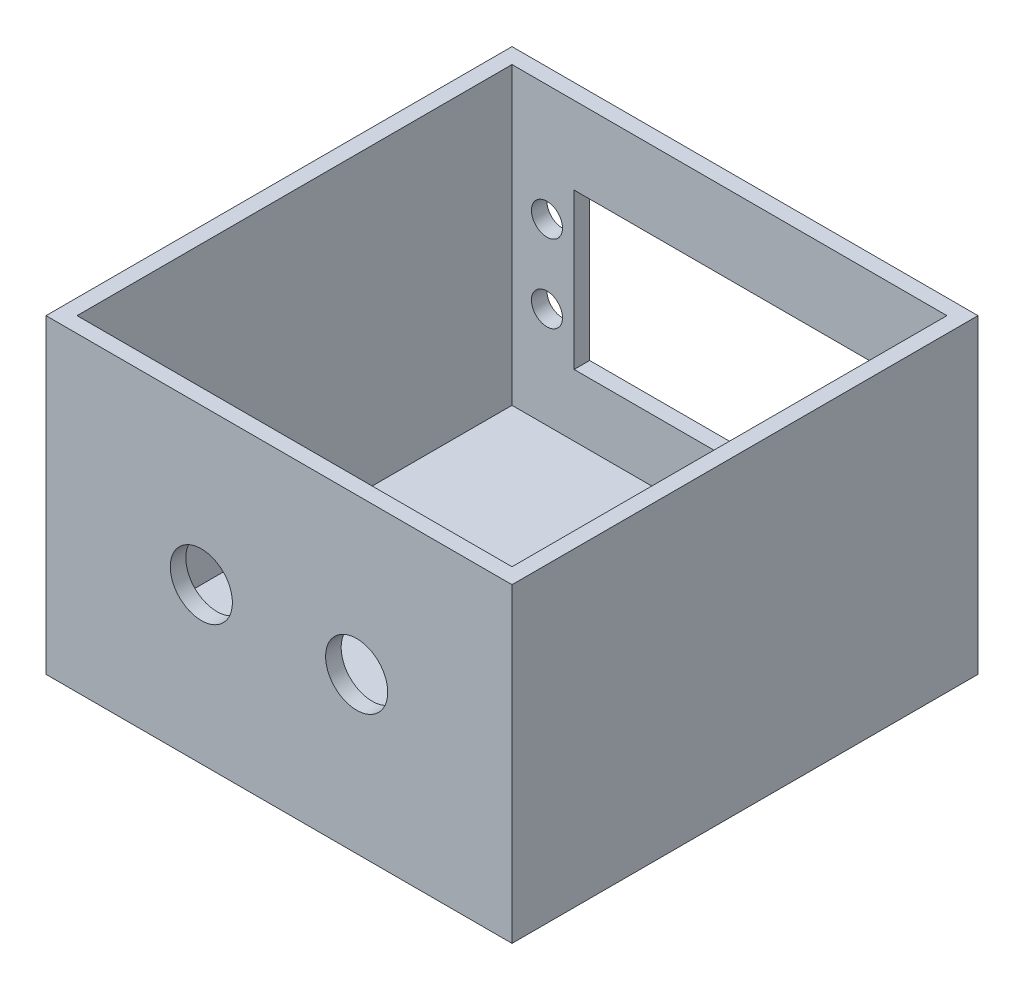
from build123d import *

# Parameters (mm, degrees)
IZIM2_W                     = 60
IZIM2_H                     = 40
Y_KSEKLIK_EKSTR_ZYON1_DEPTH = 60
BO_ALTMA1_T                 = -2
KES_EKSTR_ZYON2_REACH       = 95.808
IZIM4_R                     = 2
IZIM4_W                     = 40
IZIM4_H                     = 20
KES_EKSTR_ZYON3_REACH       = 95.808
IZIM5_R                     = 2
KES_EKSTR_ZYON4_REACH       = 95.808
IZIM6_R                     = 4


with BuildPart() as part:
    # Çizim2 → Yükseklik-Ekstrüzyon1 (new body)
    with BuildSketch(Plane.XY):
        with Locations((30, 20)):
            Rectangle(IZIM2_W, IZIM2_H)
    extrude(amount=Y_KSEKLIK_EKSTR_ZYON1_DEPTH)

    # İç Boşaltma1
    bo_altma1_openings = [part.faces().sort_by_distance(p)[0] for p in [
        (30, 40, 30),
    ]]
    offset(amount=BO_ALTMA1_T, openings=bo_altma1_openings, kind=Kind.INTERSECTION)

    # Çizim4 → Kes-Ekstrüzyon2 (cut, up to next)
    with BuildSketch(Plane(origin=(0, 0, 0), x_dir=(-1, 0, 0), z_dir=(0, 0, -1)), mode=Mode.PRIVATE) as kes_ekstr_zyon2_sk1:
        with Locations((-53.5, 25)):
            Circle(IZIM4_R)
    kes_ekstr_zyon2_tool1 = extrude(kes_ekstr_zyon2_sk1.sketch, amount=-KES_EKSTR_ZYON2_REACH, mode=Mode.PRIVATE) & part.part
    # Çizim4 → Kes-Ekstrüzyon2 (cut, up to next)
    with BuildSketch(Plane(origin=(0, 0, 0), x_dir=(-1, 0, 0), z_dir=(0, 0, -1)), mode=Mode.PRIVATE) as kes_ekstr_zyon2_sk2:
        with Locations((-53.5, 15)):
            Circle(IZIM4_R)
    kes_ekstr_zyon2_tool2 = extrude(kes_ekstr_zyon2_sk2.sketch, amount=-KES_EKSTR_ZYON2_REACH, mode=Mode.PRIVATE) & part.part
    # Çizim4 → Kes-Ekstrüzyon2 (cut, up to next)
    with BuildSketch(Plane(origin=(0, 0, 0), x_dir=(-1, 0, 0), z_dir=(0, 0, -1)), mode=Mode.PRIVATE) as kes_ekstr_zyon2_sk3:
        with Locations((-6.5, 15)):
            Circle(IZIM4_R)
    kes_ekstr_zyon2_tool3 = extrude(kes_ekstr_zyon2_sk3.sketch, amount=-KES_EKSTR_ZYON2_REACH, mode=Mode.PRIVATE) & part.part
    # Çizim4 → Kes-Ekstrüzyon2 (cut, up to next)
    with BuildSketch(Plane(origin=(0, 0, 0), x_dir=(-1, 0, 0), z_dir=(0, 0, -1)), mode=Mode.PRIVATE) as kes_ekstr_zyon2_sk4:
        with Locations((-6.5, 25)):
            Circle(IZIM4_R)
    kes_ekstr_zyon2_tool4 = extrude(kes_ekstr_zyon2_sk4.sketch, amount=-KES_EKSTR_ZYON2_REACH, mode=Mode.PRIVATE) & part.part
    # Çizim4 → Kes-Ekstrüzyon2 (cut, up to next)
    with BuildSketch(Plane(origin=(0, 0, 0), x_dir=(-1, 0, 0), z_dir=(0, 0, -1)), mode=Mode.PRIVATE) as kes_ekstr_zyon2_sk5:
        with Locations((-30, 20)):
            Rectangle(IZIM4_W, IZIM4_H)
    kes_ekstr_zyon2_tool5 = extrude(kes_ekstr_zyon2_sk5.sketch, amount=-KES_EKSTR_ZYON2_REACH, mode=Mode.PRIVATE) & part.part
    add(kes_ekstr_zyon2_tool1.solids().sort_by_distance((53.5, 25, 0))[0], mode=Mode.SUBTRACT)
    add(kes_ekstr_zyon2_tool2.solids().sort_by_distance((53.5, 15, 0))[0], mode=Mode.SUBTRACT)
    add(kes_ekstr_zyon2_tool3.solids().sort_by_distance((6.5, 15, 0))[0], mode=Mode.SUBTRACT)
    add(kes_ekstr_zyon2_tool4.solids().sort_by_distance((6.5, 25, 0))[0], mode=Mode.SUBTRACT)
    add(kes_ekstr_zyon2_tool5.solids().sort_by_distance((30, 20, 0))[0], mode=Mode.SUBTRACT)

    # Çizim5 → Kes-Ekstrüzyon3 (cut, up to next)
    with BuildSketch(Plane.XZ, mode=Mode.PRIVATE) as kes_ekstr_zyon3_sk1:
        with Locations(Location((30, 30, 0), (0, 0, 270))):
            Circle(IZIM5_R)
    kes_ekstr_zyon3_tool1 = extrude(kes_ekstr_zyon3_sk1.sketch, amount=-KES_EKSTR_ZYON3_REACH, mode=Mode.PRIVATE) & part.part
    # Çizim5 → Kes-Ekstrüzyon3 (cut, up to next)
    with BuildSketch(Plane.XZ, mode=Mode.PRIVATE) as kes_ekstr_zyon3_sk2:
        with Locations(Location((38, 30, 0), (0, 0, 270))):
            Circle(IZIM5_R)
    kes_ekstr_zyon3_tool2 = extrude(kes_ekstr_zyon3_sk2.sketch, amount=-KES_EKSTR_ZYON3_REACH, mode=Mode.PRIVATE) & part.part
    # Çizim5 → Kes-Ekstrüzyon3 (cut, up to next)
    with BuildSketch(Plane.XZ, mode=Mode.PRIVATE) as kes_ekstr_zyon3_sk3:
        with Locations(Location((30, 38, 0), (0, 0, 270))):
            Circle(IZIM5_R)
    kes_ekstr_zyon3_tool3 = extrude(kes_ekstr_zyon3_sk3.sketch, amount=-KES_EKSTR_ZYON3_REACH, mode=Mode.PRIVATE) & part.part
    # Çizim5 → Kes-Ekstrüzyon3 (cut, up to next)
    with BuildSketch(Plane.XZ, mode=Mode.PRIVATE) as kes_ekstr_zyon3_sk4:
        with Locations(Location((30, 22, 0), (0, 0, 90))):
            Circle(IZIM5_R)
    kes_ekstr_zyon3_tool4 = extrude(kes_ekstr_zyon3_sk4.sketch, amount=-KES_EKSTR_ZYON3_REACH, mode=Mode.PRIVATE) & part.part
    # Çizim5 → Kes-Ekstrüzyon3 (cut, up to next)
    with BuildSketch(Plane.XZ, mode=Mode.PRIVATE) as kes_ekstr_zyon3_sk5:
        with Locations(Location((22, 30, 0), (0, 0, 90))):
            Circle(IZIM5_R)
    kes_ekstr_zyon3_tool5 = extrude(kes_ekstr_zyon3_sk5.sketch, amount=-KES_EKSTR_ZYON3_REACH, mode=Mode.PRIVATE) & part.part
    add(kes_ekstr_zyon3_tool1.solids().sort_by_distance((30, 0, 30))[0], mode=Mode.SUBTRACT)
    add(kes_ekstr_zyon3_tool2.solids().sort_by_distance((38, 0, 30))[0], mode=Mode.SUBTRACT)
    add(kes_ekstr_zyon3_tool3.solids().sort_by_distance((30, 0, 38))[0], mode=Mode.SUBTRACT)
    add(kes_ekstr_zyon3_tool4.solids().sort_by_distance((30, 0, 22))[0], mode=Mode.SUBTRACT)
    add(kes_ekstr_zyon3_tool5.solids().sort_by_distance((22, 0, 30))[0], mode=Mode.SUBTRACT)

    # Çizim6 → Kes-Ekstrüzyon4 (cut, up to next)
    with BuildSketch(Plane.XY.offset(60), mode=Mode.PRIVATE) as kes_ekstr_zyon4_sk1:
        with Locations((20, 20)):
            Circle(IZIM6_R)
    kes_ekstr_zyon4_tool1 = extrude(kes_ekstr_zyon4_sk1.sketch, amount=-KES_EKSTR_ZYON4_REACH, mode=Mode.PRIVATE) & part.part
    # Çizim6 → Kes-Ekstrüzyon4 (cut, up to next)
    with BuildSketch(Plane.XY.offset(60), mode=Mode.PRIVATE) as kes_ekstr_zyon4_sk2:
        with Locations(Location((40, 20, 0), (0, 0, 180))):
            Circle(IZIM6_R)
    kes_ekstr_zyon4_tool2 = extrude(kes_ekstr_zyon4_sk2.sketch, amount=-KES_EKSTR_ZYON4_REACH, mode=Mode.PRIVATE) & part.part
    add(kes_ekstr_zyon4_tool1.solids().sort_by_distance((20, 20, 60))[0], mode=Mode.SUBTRACT)
    add(kes_ekstr_zyon4_tool2.solids().sort_by_distance((40, 20, 60))[0], mode=Mode.SUBTRACT)


solid = part.part
